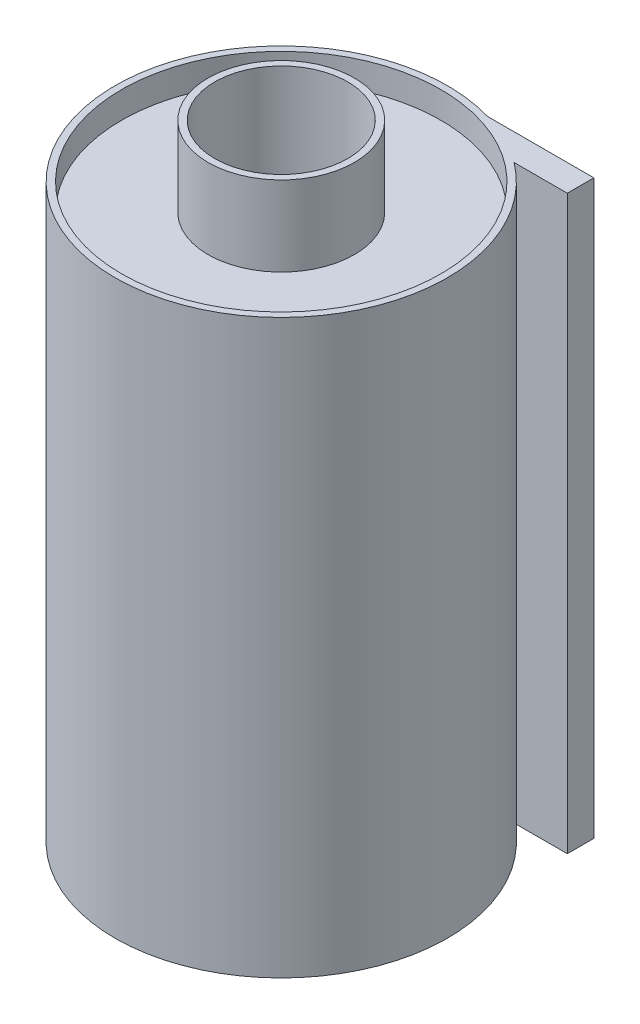
from build123d import *

# Parameters (mm, degrees)
SKETCH1_R         = 12.5
ENCLOSURE_DEPTH   = 41
SKETCH3_R         = 12.5
SKETCH3_R_2       = 12
UPPER_LIP_DEPTH   = 2
SKETCH4_R         = 5.5
UPPER_SHAFT_DEPTH = 6
SKETCH5_R         = 5
CENTRAL_CUT_DEPTH = 51.214539727
SKETCH6_R         = 12
LOWER_LIP_DEPTH   = 2
SKETCH7_R         = 5.5
SKETCH7_R_2       = 5
LOWER_SHAFT_DEPTH = 1
FILM_START        = -43
FILM_LIP_DEPTH    = 43


with BuildPart() as part:
    # Sketch1 → Enclosure (new body)
    with BuildSketch(Plane(origin=(0, 0, 0), x_dir=(1, 0, 0), z_dir=(0, 1, 0))):
        with Locations(Location((0, 0, 0), (0, 0, 270))):
            Circle(SKETCH1_R)
    extrude(amount=ENCLOSURE_DEPTH)

    # Sketch3 → Upper Lip (add)
    with BuildSketch(Plane(origin=(0, 41, 0), x_dir=(1, 0, 0), z_dir=(0, 1, 0))):
        with Locations(Location((0, 0, 0), (0, 0, 270))):
            Circle(SKETCH3_R)
        with Locations(Location((0, 0, 0), (0, 0, 270))):
            Circle(SKETCH3_R_2, mode=Mode.SUBTRACT)
    extrude(amount=UPPER_LIP_DEPTH)

    # Sketch4 → Upper Shaft (add)
    with BuildSketch(Plane(origin=(0, 41, 0), x_dir=(1, 0, 0), z_dir=(0, 1, 0))):
        with Locations(Location((0, 0, 0), (0, 0, 270))):
            Circle(SKETCH4_R)
    extrude(amount=UPPER_SHAFT_DEPTH)

    # Sketch5 → Central Cut (cut, through all)
    with BuildSketch(Plane(origin=(0, 47, 0), x_dir=(1, 0, 0), z_dir=(0, 1, 0))):
        with Locations(Location((0, 0, 0), (0, 0, 270))):
            Circle(SKETCH5_R)
    extrude(amount=-CENTRAL_CUT_DEPTH, mode=Mode.SUBTRACT)

    # Sketch6 → Lower Lip (cut)
    with BuildSketch(Plane.XZ):
        with Locations(Location((0, 0, 0), (0, 0, 90))):
            Circle(SKETCH6_R)
    extrude(amount=-LOWER_LIP_DEPTH, mode=Mode.SUBTRACT)

    # Sketch7 → Lower Shaft (add)
    with BuildSketch(Plane(origin=(0, 2, 0), x_dir=(-1, 0, 0), z_dir=(0, -1, 0))):
        with Locations(Location((0, 0, 0), (0, 0, 270))):
            Circle(SKETCH7_R)
        with Locations(Location((0, 0, 0), (0, 0, 270))):
            Circle(SKETCH7_R_2, mode=Mode.SUBTRACT)
    extrude(amount=LOWER_SHAFT_DEPTH)

    # Sketch8 → Film Lip (add)
    with BuildSketch(Plane(origin=(0, 43, 0), x_dir=(1, 0, 0), z_dir=(0, 1, 0)).offset(FILM_START)):
        with BuildLine():
            Line((3.5, 12), (11.5, 12))
            Line((11.5, 12), (11.5, 10))
            Line((11.5, 10), (7.5, 10))
            ThreePointArc((7.5, 10), (5.590169944, 11.180339887), (3.5, 12))
        make_face()
    extrude(amount=FILM_LIP_DEPTH)


solid = part.part
